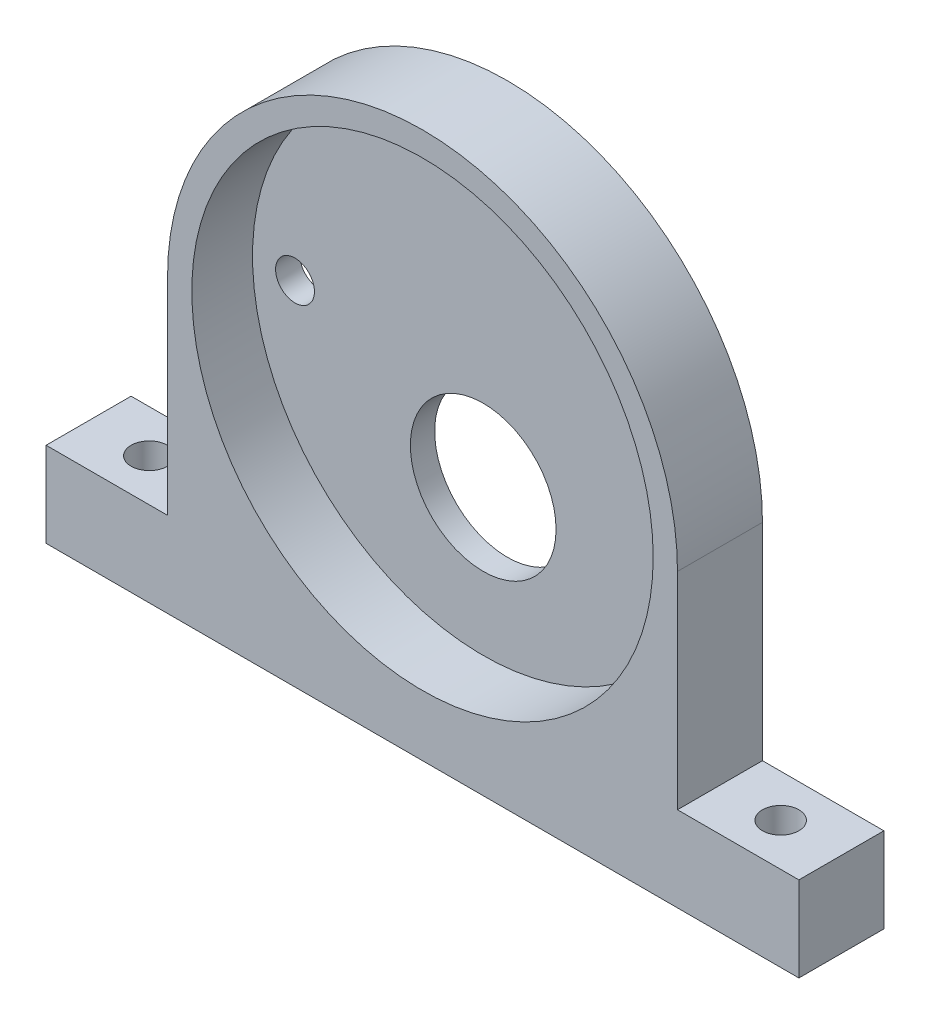
from build123d import *

# Parameters (mm, degrees)
BOSS_EXTRUDE1_DEPTH   = 7
SKETCH2_R             = 19
CUT_EXTRUDE1_DEPTH    = 5
SKETCH3_R             = 6
SKETCH3_R_2           = 1.6
CUT_EXTRUDE2_DEPTH    = 5
M3_TAPPED_HOLE1_D     = 2.5
M3_TAPPED_HOLE1_DEPTH = 5
M3_TAPPED_HOLE1_TIP   = 0.751075774
SKETCH6_R             = 1.5
CUT_EXTRUDE3_DEPTH    = 7


with BuildPart() as part:
    # Sketch1 → Boss-Extrude1 (new body)
    with BuildSketch(Plane.XY):
        with BuildLine():
            Line((31, 3.5), (21, 3.5))
            Line((21, 3.5), (21, 20.5))
            ThreePointArc((21, 20.5), (0, 41.5), (-21, 20.5))
            Line((-21, 20.5), (-21, 3.5))
            Line((-21, 3.5), (-31, 3.5))
            Line((-31, 3.5), (-31, -3.5))
            Line((-31, -3.5), (31, -3.5))
            Line((31, -3.5), (31, 3.5))
        make_face()
    extrude(amount=BOSS_EXTRUDE1_DEPTH)

    # Sketch2 → Cut-Extrude1 (cut)
    with BuildSketch(Plane.XY.offset(7)):
        with Locations((0, 20.5)):
            Circle(SKETCH2_R)
    extrude(amount=-CUT_EXTRUDE1_DEPTH, mode=Mode.SUBTRACT)

    # Sketch3 → Cut-Extrude2 (cut)
    with BuildSketch(Plane.XY.offset(2)):
        with Locations((0, 13.5)):
            Circle(SKETCH3_R)
        with Locations((15.5, 20.5)):
            Circle(SKETCH3_R_2)
        with Locations((-15.5, 20.5)):
            Circle(SKETCH3_R_2)
    extrude(amount=-CUT_EXTRUDE2_DEPTH, mode=Mode.SUBTRACT)

    # M3 Tapped Hole1
    with Locations(Plane(origin=(-14, -3.5, 3.5), x_dir=(0, 0, -1), z_dir=(0, -1, 0))):
        with Locations((0, 0), (0, 28)):
            Hole(M3_TAPPED_HOLE1_D / 2, depth=M3_TAPPED_HOLE1_DEPTH)
            with Locations((0, 0, -(M3_TAPPED_HOLE1_DEPTH + M3_TAPPED_HOLE1_TIP / 2))):  # 118° drill point
                Cone(0, M3_TAPPED_HOLE1_D / 2, M3_TAPPED_HOLE1_TIP, mode=Mode.SUBTRACT)

    # Sketch6 → Cut-Extrude3 (cut)
    with BuildSketch(Plane(origin=(0, 3.5, 0), x_dir=(1, 0, 0), z_dir=(0, 1, 0))):
        with Locations(Location((-26, -3.5, 0), (0, 0, 270))):
            Circle(SKETCH6_R)
        with Locations(Location((26, -3.5, 0), (0, 0, 270))):
            Circle(SKETCH6_R)
    extrude(amount=-CUT_EXTRUDE3_DEPTH, mode=Mode.SUBTRACT)


solid = part.part
